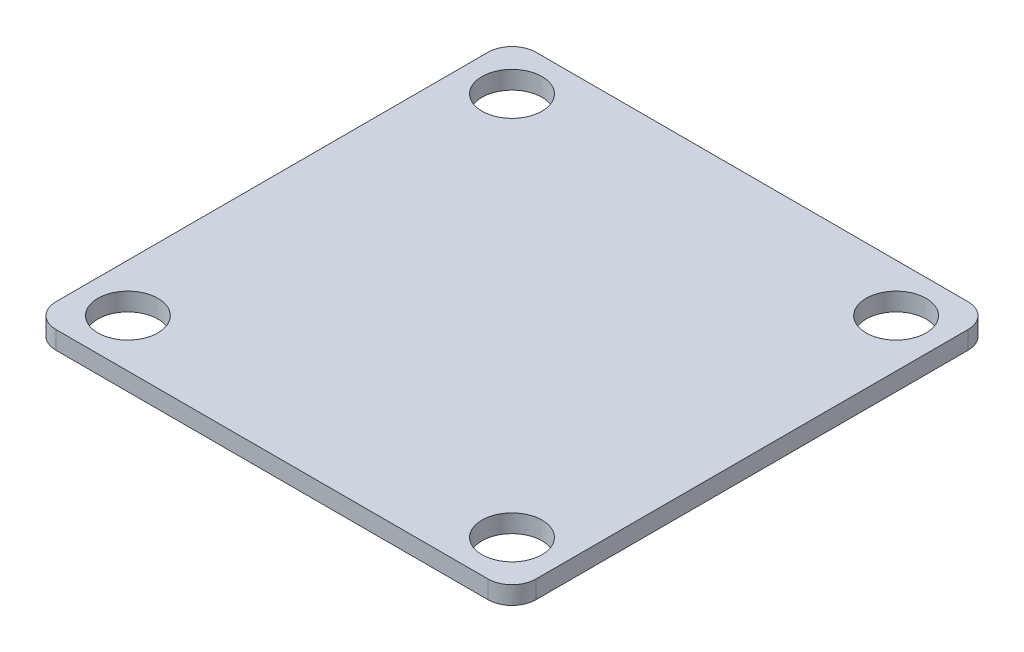
from build123d import *

# Parameters (mm, degrees)
BOSS_EXTRU_1_DEPTH      = 3
ESQUISSE2_R             = 5
ENL_V_MAT_EXTRU_1_DEPTH = 57.648036153


with BuildPart() as part:
    # Esquisse1 → Boss.-Extru.1 (new body)
    with BuildSketch(Plane(origin=(0, 0, 0), x_dir=(1, 0, 0), z_dir=(0, 1, 0))):
        with BuildLine():
            Line((-36, 40), (36, 40))
            ThreePointArc((36, 40), (38.828427125, 38.828427125), (40, 36))
            Line((40, 36), (40, -36))
            ThreePointArc((40, -36), (38.828427125, -38.828427125), (36, -40))
            Line((36, -40), (-36, -40))
            ThreePointArc((-36, -40), (-38.828427125, -38.828427125), (-40, -36))
            Line((-40, -36), (-40, 36))
            ThreePointArc((-40, 36), (-38.828427125, 38.828427125), (-36, 40))
        make_face()
    extrude(amount=BOSS_EXTRU_1_DEPTH)

    # Esquisse2 → Enlèv. mat.-Extru.1 (cut, through all)
    with BuildSketch(Plane(origin=(0, 3, 0), x_dir=(1, 0, 0), z_dir=(0, 1, 0))):
        with Locations(Location((-32, 32, 0), (0, 0, 270))):
            Circle(ESQUISSE2_R)
        with Locations(Location((32, 32, 0), (0, 0, 270))):
            Circle(ESQUISSE2_R)
        with Locations(Location((32, -32, 0), (0, 0, 270))):
            Circle(ESQUISSE2_R)
        with Locations(Location((-32, -32, 0), (0, 0, 270))):
            Circle(ESQUISSE2_R)
    extrude(amount=-ENL_V_MAT_EXTRU_1_DEPTH, mode=Mode.SUBTRACT)


solid = part.part
